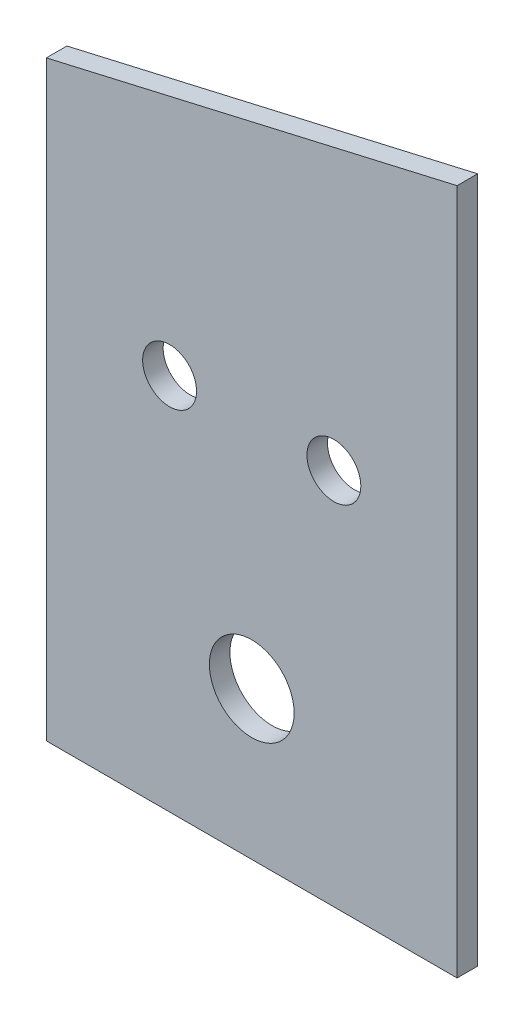
from build123d import *

# Parameters (mm, degrees)
SKETCH2_W           = 31.75
SKETCH2_H           = 22.86
SKETCH2_R           = 3.2766
SKETCH2_H_2         = 12.7
SKETCH2_R_2         = 2.0828
SKETCH2_H_3         = 10.16
BOSS_EXTRUDE1_DEPTH = 1.5875


with BuildPart() as part:
    # Sketch2 → Boss-Extrude1 (new body)
    # profile 1 of 4: a face of its own
    with BuildSketch(Plane.XY):
        with Locations((15.875, 11.43)):
            Rectangle(SKETCH2_W, SKETCH2_H)
        with Locations((15.875, 11.43)):
            Circle(SKETCH2_R, mode=Mode.SUBTRACT)
    # profile 2 of 4: a face of its own
    with BuildSketch(Plane.XY):
        with Locations((15.875, 29.21)):
            Rectangle(SKETCH2_W, SKETCH2_H_2)
        with Locations((9.525, 29.21)):
            Circle(SKETCH2_R_2, mode=Mode.SUBTRACT)
        with Locations((22.225, 29.21)):
            Circle(SKETCH2_R_2, mode=Mode.SUBTRACT)
    # profile 3 of 4: a face of its own
    with BuildSketch(Plane.XY):
        with Locations((15.875, 40.64)):
            Rectangle(SKETCH2_W, SKETCH2_H_3)
    # profile 4 of 4: a face of its own
    with BuildSketch(Plane.XY):
        Polygon((31.75, 53.041010695), (31.75, 45.72), (0, 45.72), align=None)
    extrude(amount=BOSS_EXTRUDE1_DEPTH)


solid = part.part
